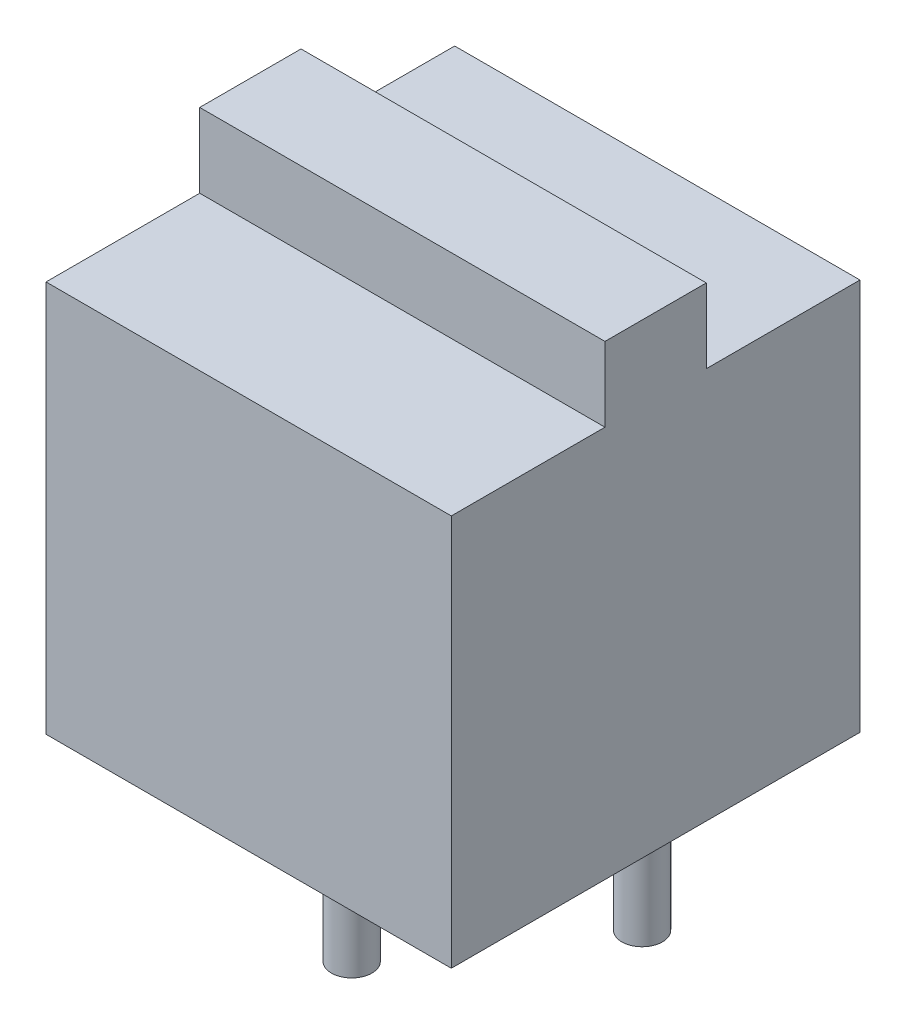
from build123d import *

# Parameters (mm, degrees)
CROQUIS1_W              = 12
CROQUIS1_H              = 12.1
SALIENTE_EXTRUIR1_DEPTH = 11.6
CROQUIS2_W              = 12
CROQUIS2_H              = 3
SALIENTE_EXTRUIR2_DEPTH = 2.2
CROQUIS3_R              = 0.6
SALIENTE_EXTRUIR3_DEPTH = 3.6


with BuildPart() as part:
    # Croquis1 → Saliente-Extruir1 (new body)
    with BuildSketch(Plane(origin=(0, 0, 0), x_dir=(1, 0, 0), z_dir=(0, 1, 0))):
        Rectangle(CROQUIS1_W, CROQUIS1_H)
    extrude(amount=SALIENTE_EXTRUIR1_DEPTH)

    # Croquis2 → Saliente-Extruir2 (add)
    with BuildSketch(Plane(origin=(0, 11.6, 0), x_dir=(1, 0, 0), z_dir=(0, 1, 0))):
        Rectangle(CROQUIS2_W, CROQUIS2_H)
    extrude(amount=SALIENTE_EXTRUIR2_DEPTH)

    # Croquis3 → Saliente-Extruir3 (add)
    with BuildSketch(Plane.XZ):
        with Locations(Location((-2.75, -1.35, 0), (0, 0, 270))):
            Circle(CROQUIS3_R)
        with Locations(Location((0.75, 3.75, 0), (0, 0, 270))):
            Circle(CROQUIS3_R)
        with Locations(Location((4.25, -1.35, 0), (0, 0, 270))):
            Circle(CROQUIS3_R)
    extrude(amount=SALIENTE_EXTRUIR3_DEPTH)


solid = part.part
